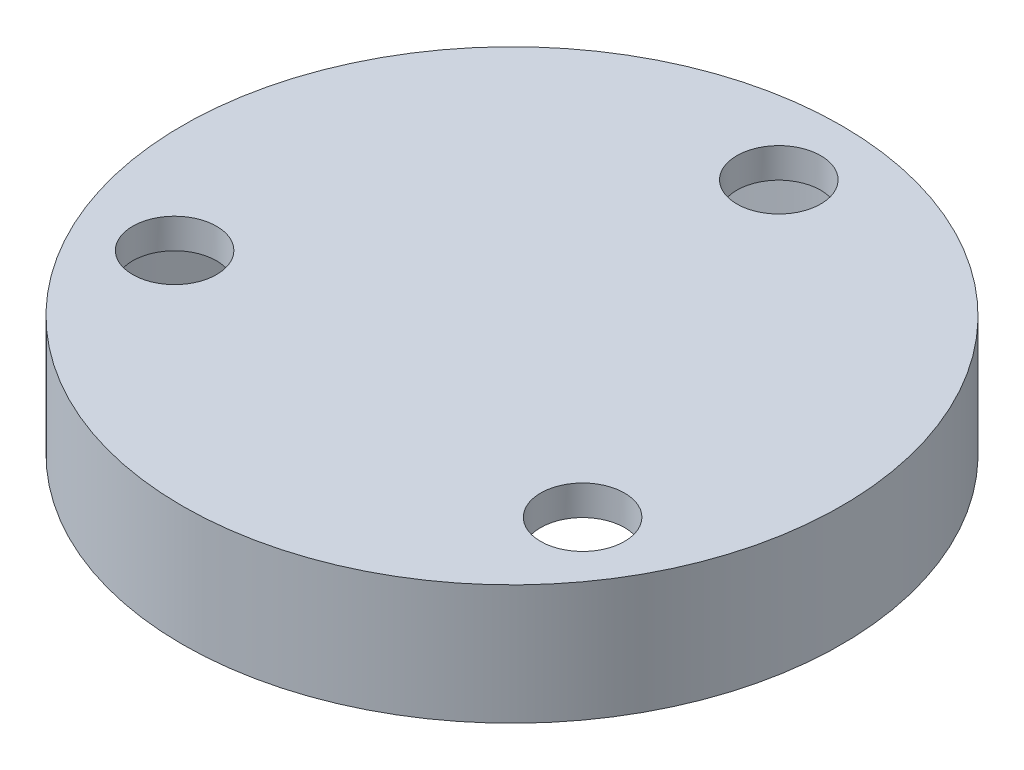
from build123d import *

# Parameters (mm, degrees)
SKETCH1_R             = 55
BOSS_EXTRUDE1_DEPTH   = 20
SKETCH2_R             = 50
CUT_EXTRUDE1_DEPTH    = 15
F_1_0MM_DOWEL_HOLE1_D = 14


with BuildPart() as part:
    # Sketch1 → Boss-Extrude1 (new body)
    with BuildSketch(Plane(origin=(0, 0, 0), x_dir=(1, 0, 0), z_dir=(0, 1, 0))):
        with Locations(Location((0, 0, 0), (0, 0, 270))):
            Circle(SKETCH1_R)
    extrude(amount=BOSS_EXTRUDE1_DEPTH)

    # Sketch2 → Cut-Extrude1 (cut)
    with BuildSketch(Plane.XZ):
        with Locations(Location((0, 0, 0), (0, 0, 270))):
            Circle(SKETCH2_R)
    extrude(amount=-CUT_EXTRUDE1_DEPTH, mode=Mode.SUBTRACT)

    # Ø1.0mm Dowel Hole1 (through all)
    with Locations(Plane(origin=(0, 20, 0), x_dir=(1, 0, 0), z_dir=(0, 1, 0))):
        with Locations((34.99959956, -23.216977207), (2.60669228, 41.919030945), (-37.60629184, -18.702053738)):
            Hole(F_1_0MM_DOWEL_HOLE1_D / 2)


solid = part.part
